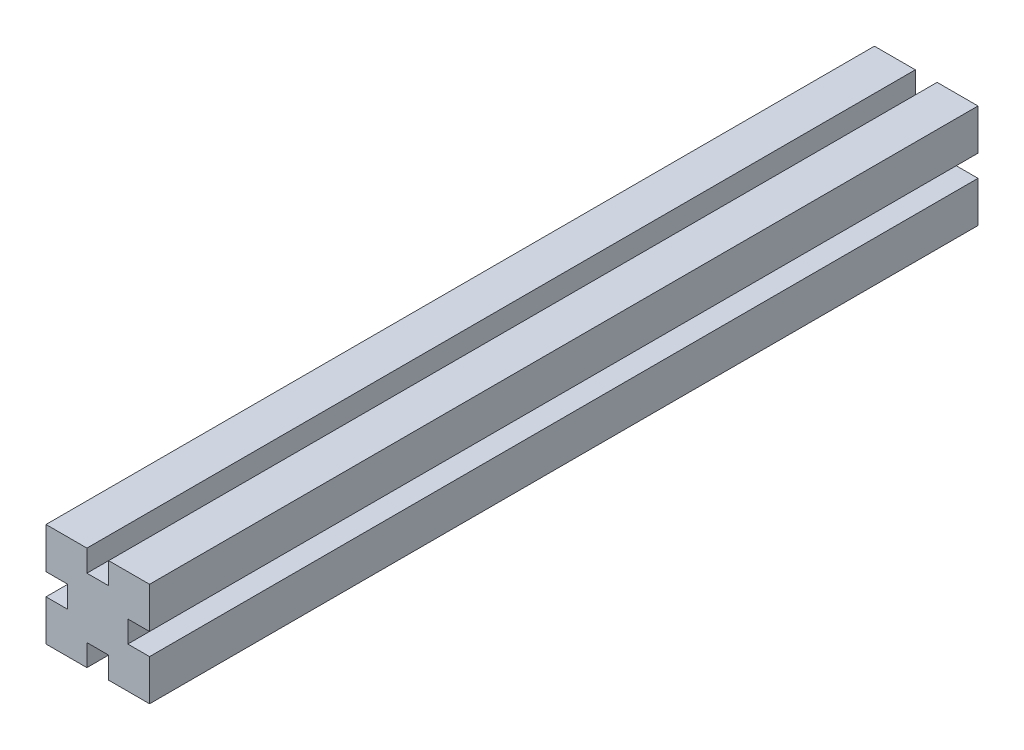
from build123d import *

# Parameters (mm, degrees)
PROFILE_DEPTH = 304.8


with BuildPart() as part:
    # Sketch1 → Profile (new body)
    with BuildSketch(Plane.XY):
        Polygon((-19.05, -19.05), (-4, -19.05), (-4, -11.05), (4, -11.05), (4, -19.05), (19.05, -19.05), (19.05, -4), (11.05, -4), (11.05, 4), (19.05, 4), (19.05, 19.05), (4, 19.05), (4, 11.05), (-4, 11.05), (-4, 19.05), (-19.05, 19.05), (-19.05, 4), (-11.05, 4), (-11.05, -4), (-19.05, -4), align=None)
    extrude(amount=PROFILE_DEPTH)


solid = part.part
